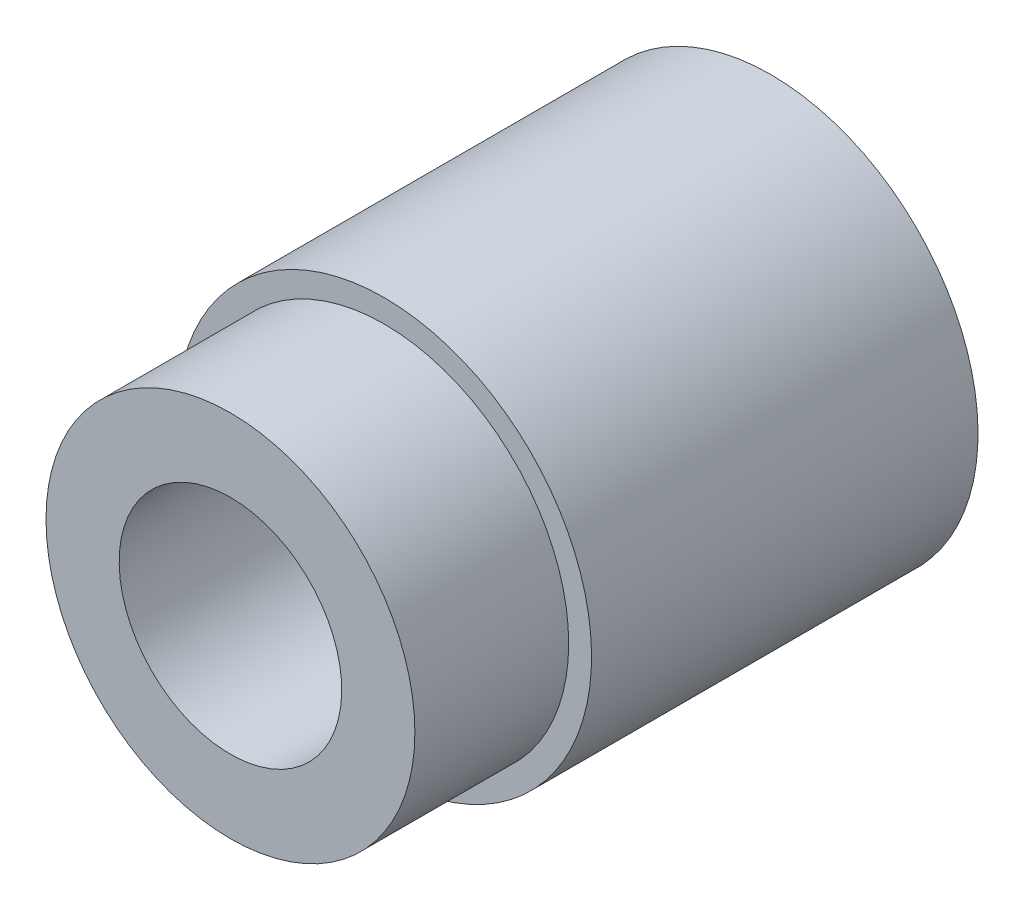
from build123d import *


with BuildPart() as part:
    # Sketch1 → Revolve1 (revolve)
    with BuildSketch(Plane(origin=(0, 0, 0), x_dir=(0, 0, -1), z_dir=(1, 0, 0))):
        Polygon((0, 3.6195), (-17.5768, 3.6195), (-17.5768, 6), (-12.573, 6), (-12.573, 6.7437), (0, 6.7437), align=None)
    revolve(axis=Axis((0, 0, 0), (0, 0, 1)))


solid = part.part
